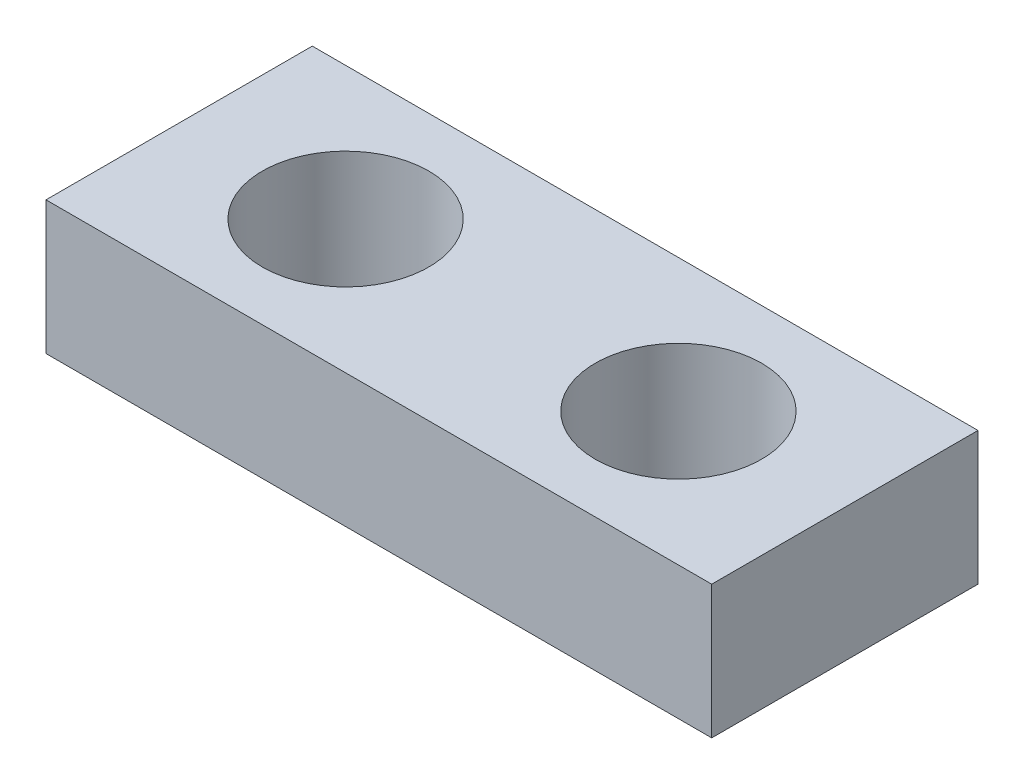
from build123d import *

# Parameters (mm, degrees)
SKETCH1_W           = 127
SKETCH1_H           = 50.8
BOSS_EXTRUDE1_DEPTH = 25.4
SKETCH2_R           = 15.875
CUT_EXTRUDE1_DEPTH  = 140.121529606


with BuildPart() as part:
    # Sketch1 → Boss-Extrude1 (new body)
    with BuildSketch(Plane(origin=(0, 0, 0), x_dir=(1, 0, 0), z_dir=(0, 1, 0))):
        with Locations((63.5, 25.4)):
            Rectangle(SKETCH1_W, SKETCH1_H)
    extrude(amount=BOSS_EXTRUDE1_DEPTH)

    # Sketch2 → Cut-Extrude1 (cut, through all)
    with BuildSketch(Plane(origin=(0, 25.4, 0), x_dir=(1, 0, 0), z_dir=(0, 1, 0))):
        with Locations(Location((31.75, 25.4, 0), (0, 0, 270))):
            Circle(SKETCH2_R)
        with Locations(Location((95.25, 25.4, 0), (0, 0, 270))):
            Circle(SKETCH2_R)
    extrude(amount=-CUT_EXTRUDE1_DEPTH, mode=Mode.SUBTRACT)


solid = part.part
